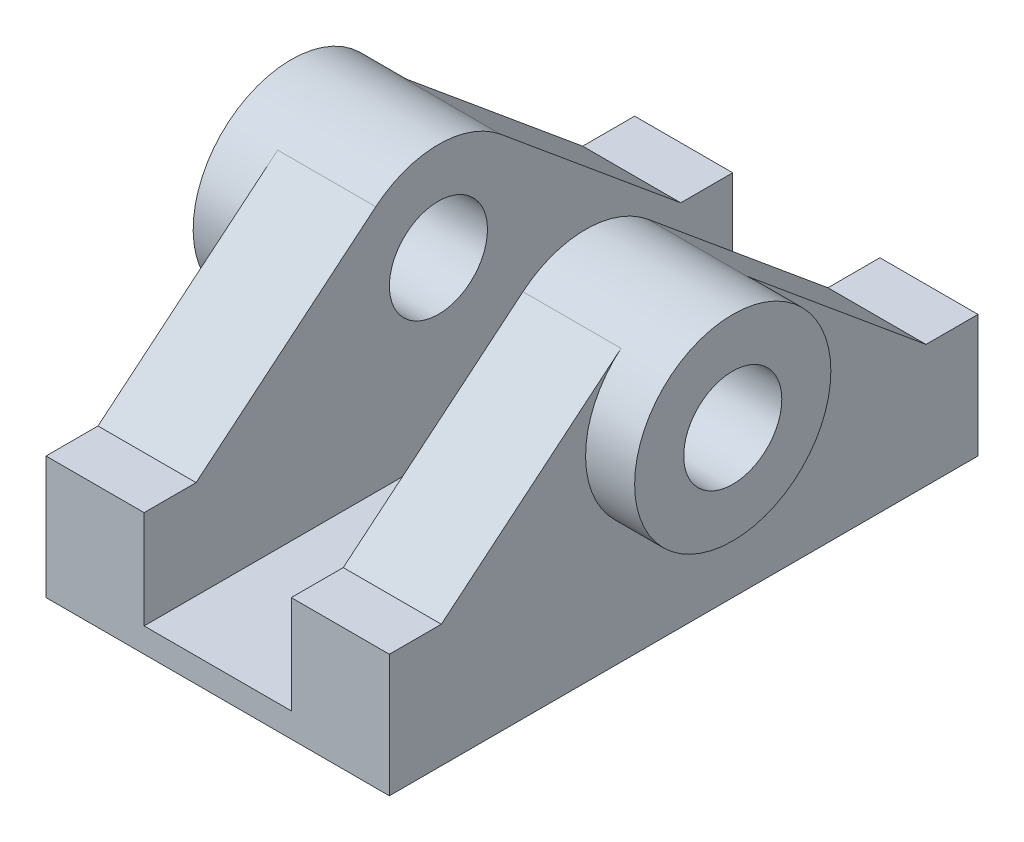
from build123d import *

# Parameters (mm, degrees)
SKETCH1_W           = 70
SKETCH1_H           = 120
BOSS_EXTRUDE1_DEPTH = 25
SKETCH2_W           = 30
SKETCH2_H           = 120
CUT_EXTRUDE1_DEPTH  = 20
SKETCH4_R           = 20
SKETCH4_R_2         = 10
BOSS_EXTRUDE2_DEPTH = 30
BOSS_EXTRUDE3_DEPTH = 20


with BuildPart() as part:
    # Sketch1 → Boss-Extrude1 (new body)
    with BuildSketch(Plane(origin=(0, 0, 0), x_dir=(1, 0, 0), z_dir=(0, 1, 0))):
        Rectangle(SKETCH1_W, SKETCH1_H)
    extrude(amount=BOSS_EXTRUDE1_DEPTH)

    # Sketch2 → Cut-Extrude1 (cut)
    with BuildSketch(Plane(origin=(0, 25, 0), x_dir=(1, 0, 0), z_dir=(0, 1, 0))):
        Rectangle(SKETCH2_W, SKETCH2_H)
    extrude(amount=-CUT_EXTRUDE1_DEPTH, mode=Mode.SUBTRACT)

    # Sketch4 → Boss-Extrude2 (add)
    with BuildSketch(Plane(origin=(45, 0, 0), x_dir=(0, 0, -1), z_dir=(1, 0, 0))):
        with Locations((0, 40)):
            Circle(SKETCH4_R)
        with Locations((0, 40)):
            Circle(SKETCH4_R_2, mode=Mode.SUBTRACT)
    boss_extrude2 = extrude(amount=-BOSS_EXTRUDE2_DEPTH)

    # Mirror1: Boss-Extrude2 across plane
    add(boss_extrude2.mirror(Plane(origin=(0, 0, 0), x_dir=(0, 0, 1), z_dir=(1, 0, 0))))

    # Sketch5 → Boss-Extrude3 (add)
    with BuildSketch(Plane.ZY.offset(35)):
        with BuildLine():
            ThreePointArc((-13.228756555, 25), (-19.997722926, 40.301790929), (-12.770097474, 55.392355587))
            Line((-12.770097474, 55.392355587), (-49.403329543, 25))
            Line((-49.403329543, 25), (-13.228756555, 25))
        make_face()
        with BuildLine():
            Line((49.403329543, 25), (12.770097474, 55.392355587))
            ThreePointArc((12.770097474, 55.392355587), (18.10251294, 48.50288335), (20, 40))
            ThreePointArc((20, 40), (18.228756555, 31.771243445), (13.228756555, 25))
            Line((13.228756555, 25), (49.403329543, 25))
        make_face()
    boss_extrude3 = extrude(amount=-BOSS_EXTRUDE3_DEPTH)

    # Mirror2: Boss-Extrude3 across plane
    add(boss_extrude3.mirror(Plane(origin=(0, 0, 0), x_dir=(0, 0, 1), z_dir=(1, 0, 0))))


solid = part.part
